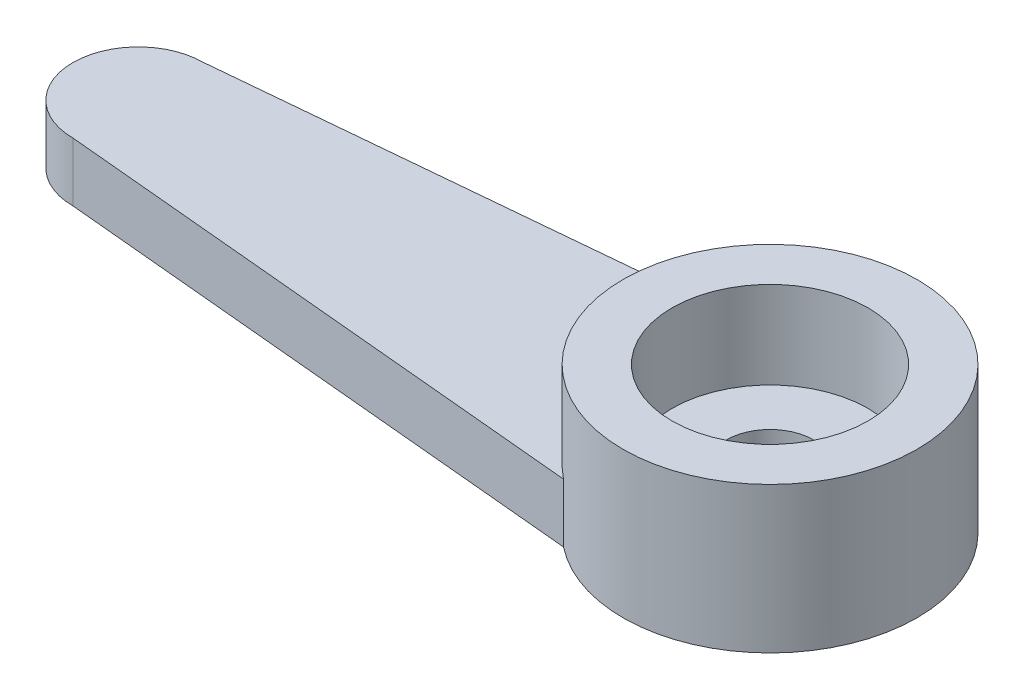
from build123d import *

# Parameters (mm, degrees)
ESTRUSIONE_ESTRUSIONE1_DEPTH = 1.35
SCHIZZO2_R                   = 3.375
ESTRUSIONE_ESTRUSIONE2_DEPTH = 2
SCHIZZO3_R                   = 2.25
TAGLIO_ESTRUSIONE1_DEPTH     = 2
SCHIZZO4_R                   = 1
TAGLIO_ESTRUSIONE2_DEPTH     = 17.47393775


with BuildPart() as part:
    # Schizzo1 → Estrusione-Estrusione1 (new body)
    with BuildSketch(Plane(origin=(0, 0, 0), x_dir=(1, 0, 0), z_dir=(0, 1, 0))):
        with BuildLine():
            ThreePointArc((-2.090005981, -2.65), (-3.375, 0), (-2.090005981, 2.65))
            Line((-2.090005981, 2.65), (-14.5, 1.5))
            ThreePointArc((-14.5, 1.5), (-16, 0), (-14.5, -1.5))
            Line((-14.5, -1.5), (-2.090005981, -2.65))
        make_face()
        with BuildLine():
            ThreePointArc((3.375, 0), (1.472558117, 3.036807138), (-2.090005981, 2.65))
            Line((-2.090005981, 2.65), (-2.090005981, -2.65))
            ThreePointArc((-2.090005981, -2.65), (1.472558117, -3.036807138), (3.375, 0))
        make_face()
        with BuildLine():
            Line((-2.090005981, -2.65), (-2.090005981, 2.65))
            ThreePointArc((-2.090005981, 2.65), (-3.375, 0), (-2.090005981, -2.65))
        make_face()
    extrude(amount=ESTRUSIONE_ESTRUSIONE1_DEPTH)

    # Schizzo2 → Estrusione-Estrusione2 (add)
    with BuildSketch(Plane(origin=(0, 1.35, 0), x_dir=(1, 0, 0), z_dir=(0, 1, 0))):
        with Locations(Location((0, 0, 0), (0, 0, 128.262191128))):
            Circle(SCHIZZO2_R)
    extrude(amount=ESTRUSIONE_ESTRUSIONE2_DEPTH)

    # Schizzo3 → Taglio-Estrusione1 (cut)
    with BuildSketch(Plane(origin=(0, 3.35, 0), x_dir=(1, 0, 0), z_dir=(0, 1, 0))):
        with Locations(Location((0, 0, 0), (0, 0, 270))):
            Circle(SCHIZZO3_R)
    extrude(amount=-TAGLIO_ESTRUSIONE1_DEPTH, mode=Mode.SUBTRACT)

    # Schizzo4 → Taglio-Estrusione2 (cut, through all)
    with BuildSketch(Plane(origin=(0, 1.35, 0), x_dir=(1, 0, 0), z_dir=(0, 1, 0))):
        with Locations(Location((0, 0, 0), (0, 0, 270))):
            Circle(SCHIZZO4_R)
    extrude(amount=-TAGLIO_ESTRUSIONE2_DEPTH, mode=Mode.SUBTRACT)


solid = part.part
